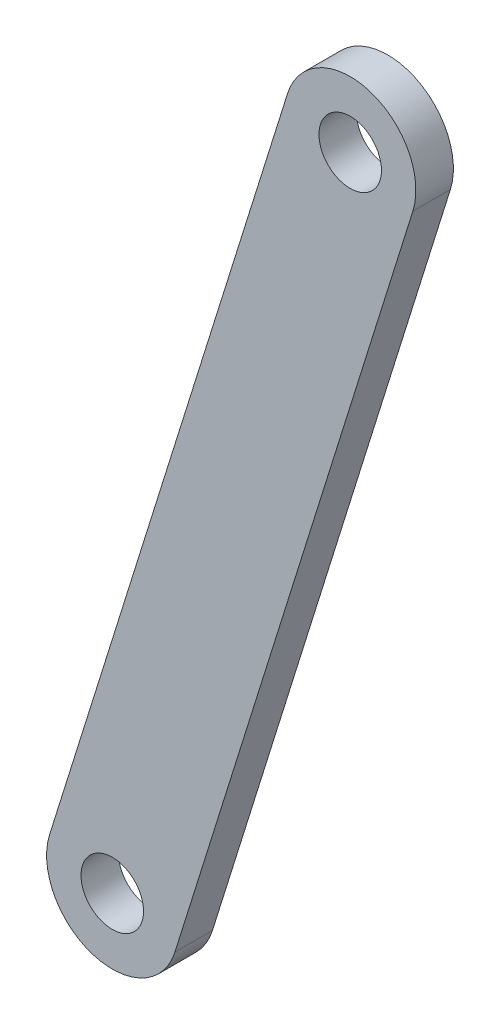
from build123d import *

# Parameters (mm, degrees)
SKETCH1_R           = 2.5
BOSS_EXTRUDE1_DEPTH = 3


with BuildPart() as part:
    # Sketch1 → Boss-Extrude1 (new body)
    with BuildSketch(Plane.XY):
        with BuildLine():
            Line((12.385902695, 41.182709486), (-6.639825617, -19.643563313))
            ThreePointArc((-6.639825617, -19.643563313), (-3.196475078, -26.221430526), (3.381392135, -22.778079987))
            Line((3.381392135, -22.778079987), (22.407120447, 38.048192812))
            ThreePointArc((22.407120447, 38.048192812), (18.963769908, 44.626060024), (12.385902695, 41.182709486))
        make_face()
        with Locations((17.396511571, 39.615451149)):
            Circle(SKETCH1_R, mode=Mode.SUBTRACT)
        with Locations((-1.629216741, -21.21082165)):
            Circle(SKETCH1_R, mode=Mode.SUBTRACT)
    extrude(amount=BOSS_EXTRUDE1_DEPTH)


solid = part.part
